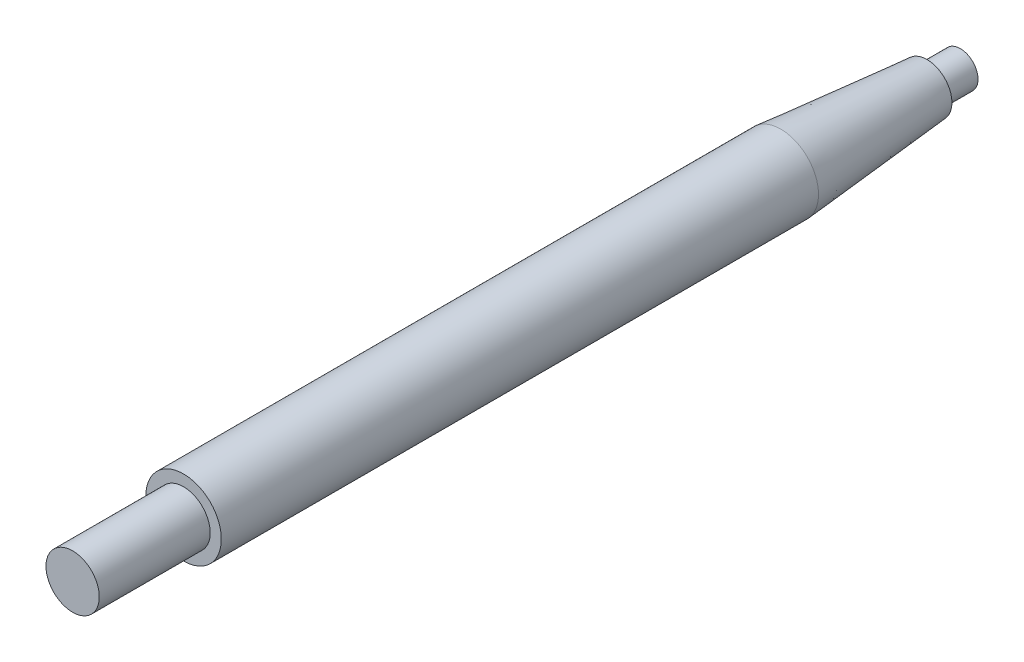
from build123d import *


with BuildPart() as part:
    # Base Sketch → Revolve1 (revolve)
    with BuildSketch(Plane(origin=(0, 0, 0), x_dir=(1, 0, 0), z_dir=(0, 1, 0)), mode=Mode.PRIVATE) as revolve1_sk:
        Polygon((-11.225361683, 153.992599386), (-12.843485106, 153.992599386), (-12.843485106, 161.492599386), (-16.843485106, 161.492599386), (-16.843485106, -13.507400614), (-16.843485106, -38.507400614), (-10.843485106, -38.507400614), (-10.843485106, -13.507400614), (-8.343485106, -13.507400614), (-8.343485106, 121.052599386), align=None)
    revolve(revolve1_sk.sketch.rotate(Axis((-16.843485106, 0, -161.492599386), (0, 0, 1)), 180), axis=Axis((-16.843485106, 0, -161.492599386), (0, 0, 1)))


solid = part.part
